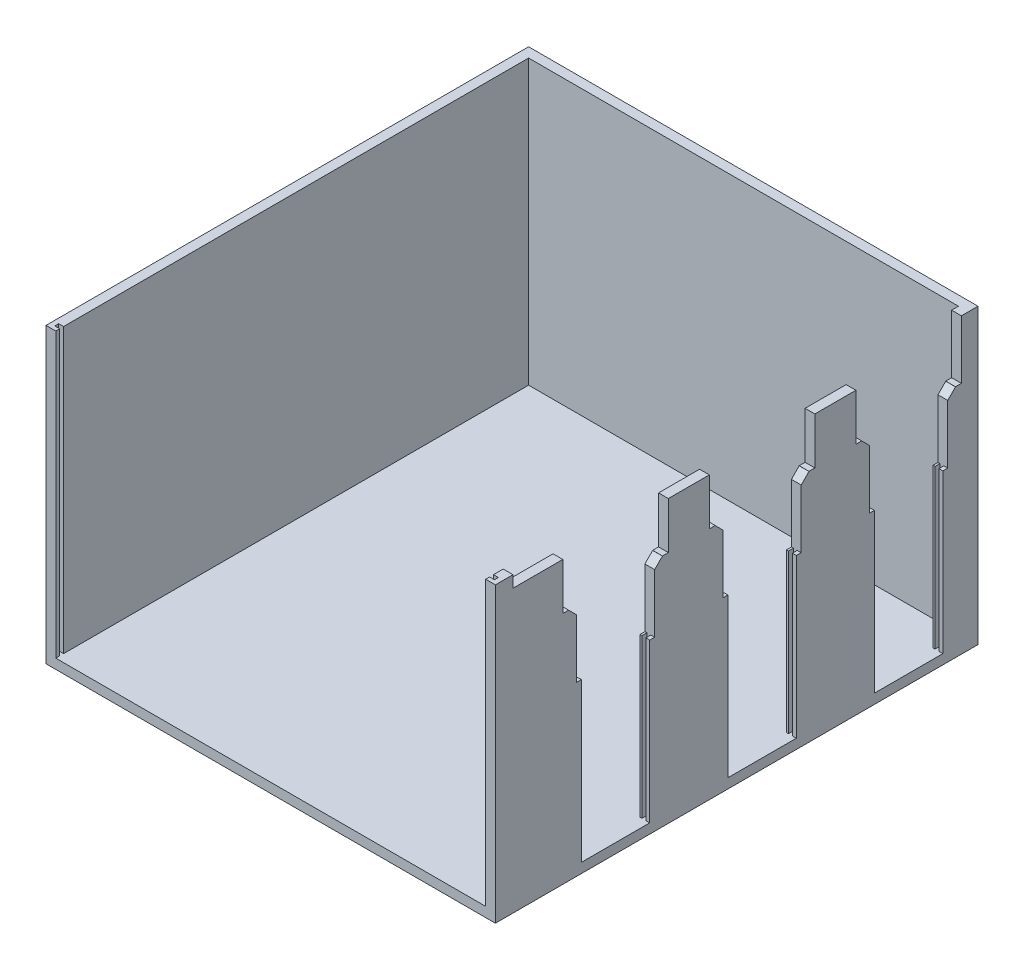
from build123d import *

# Parameters (mm, degrees)
SZKIC1_W                    = 230
SZKIC1_H                    = 150
DODANIE_WYCI_GNI_CIE1_DEPTH = 5
DODANIE_WYCI_GNI_CIE2_DEPTH = 242
WYTNIJ_WYCI_GNI_CIE1_REACH  = 347.737
SZKIC4_W                    = 30
SZKIC4_H                    = 6
WYTNIJ_WYCI_GNI_CIE2_DEPTH  = 5
SZKIC7_W                    = 2.5
SZKIC7_H                    = 2
WYTNIJ_WYCI_GNI_CIE3_DEPTH  = 145


with BuildPart() as part:
    # Szkic1 → Dodanie-wyciągnięcie1 (new body)
    with BuildSketch(Plane.XY):
        Rectangle(SZKIC1_W, SZKIC1_H)
    extrude(amount=DODANIE_WYCI_GNI_CIE1_DEPTH)

    # Szkic3 → Dodanie-wyciągnięcie2 (add)
    with BuildSketch(Plane.XY.offset(5)):
        Polygon((115, -75), (115, 75), (110, 75), (110, 70), (110, -70), (-110, -70), (-110, 70), (-110, 75), (-115, 75), (-115, -75), align=None)
    extrude(amount=DODANIE_WYCI_GNI_CIE2_DEPTH)

    # Szkic4 → Wytnij-wyciągnięcie1 (cut, up to next)
    with BuildSketch(Plane(origin=(115, 0, 0), x_dir=(0, 0, -1), z_dir=(1, 0, 0)), mode=Mode.PRIVATE) as wytnij_wyci_gni_cie1_sk1:
        with Locations((-223, 72)):
            Rectangle(SZKIC4_W, SZKIC4_H)
    wytnij_wyci_gni_cie1_tool1 = extrude(wytnij_wyci_gni_cie1_sk1.sketch, amount=-WYTNIJ_WYCI_GNI_CIE1_REACH, mode=Mode.PRIVATE) & part.part
    # Szkic4 → Wytnij-wyciągnięcie1 (cut, up to next)
    with BuildSketch(Plane(origin=(115, 0, 0), x_dir=(0, 0, -1), z_dir=(1, 0, 0)), mode=Mode.PRIVATE) as wytnij_wyci_gni_cie1_sk2:
        with Locations((-148, 72)):
            Rectangle(SZKIC4_W, SZKIC4_H)
    wytnij_wyci_gni_cie1_tool2 = extrude(wytnij_wyci_gni_cie1_sk2.sketch, amount=-WYTNIJ_WYCI_GNI_CIE1_REACH, mode=Mode.PRIVATE) & part.part
    # Szkic4 → Wytnij-wyciągnięcie1 (cut, up to next)
    with BuildSketch(Plane(origin=(115, 0, 0), x_dir=(0, 0, -1), z_dir=(1, 0, 0)), mode=Mode.PRIVATE) as wytnij_wyci_gni_cie1_sk3:
        with Locations((-73, 72)):
            Rectangle(SZKIC4_W, SZKIC4_H)
    wytnij_wyci_gni_cie1_tool3 = extrude(wytnij_wyci_gni_cie1_sk3.sketch, amount=-WYTNIJ_WYCI_GNI_CIE1_REACH, mode=Mode.PRIVATE) & part.part
    add(wytnij_wyci_gni_cie1_tool1.solids().sort_by_distance((115, 72, 223))[0], mode=Mode.SUBTRACT)
    add(wytnij_wyci_gni_cie1_tool2.solids().sort_by_distance((115, 72, 148))[0], mode=Mode.SUBTRACT)
    add(wytnij_wyci_gni_cie1_tool3.solids().sort_by_distance((115, 72, 73))[0], mode=Mode.SUBTRACT)

    # Szkic6 → Wytnij-wyciągnięcie2 (cut)
    with BuildSketch(Plane(origin=(115, 0, 0), x_dir=(0, 0, -1), z_dir=(1, 0, 0))):
        Polygon((-11.5, 45), (-11.5, 45.054636006), (-8.5, 45.054636006), (-8.5, 75), (-58, 75), (-58, 69), (-62.5, 69), (-62.5, 45.054636006), (-59.5, 45.054636006), (-59.5, 45), (-55.5, 41), (-55.5, 11), (-15.5, 11), (-15.5, 41), align=None)
        Polygon((-83.5, 45.054636006), (-83.5, 69), (-88, 69), (-88, 75), (-133, 75), (-133, 69), (-137.5, 69), (-137.5, 45.054636006), (-134.5, 45.054636006), (-134.5, 45), (-130.5, 41), (-130.5, 11), (-90.5, 11), (-90.5, 41), (-86.5, 45), (-86.5, 45.054636006), align=None)
        Polygon((-158.5, 45.054636006), (-158.5, 69), (-163, 69), (-163, 75), (-208, 75), (-208, 69), (-212.5, 69), (-212.5, 45.054636006), (-209.5, 45.054636006), (-209.5, 45), (-205.5, 41), (-205.5, 11), (-165.5, 11), (-165.5, 41), (-161.5, 45), (-161.5, 45.054636006), align=None)
    extrude(amount=-WYTNIJ_WYCI_GNI_CIE2_DEPTH, mode=Mode.SUBTRACT)

    # Szkic7 → Wytnij-wyciągnięcie3 (cut)
    with BuildSketch(Plane(origin=(0, 75, 0), x_dir=(1, 0, 0), z_dir=(0, 1, 0))):
        with Locations((-111.25, -244)):
            Rectangle(SZKIC7_W, SZKIC7_H)
        with Locations((111.25, -244)):
            Rectangle(SZKIC7_W, SZKIC7_H)
        Polygon((111, -203), (111, -205.5), (113, -205.5), (113, -203), (115, -203), (115, -168), (113, -168), (113, -165.5), (111, -165.5), (111, -168), (110, -168), (110, -203), align=None)
        Polygon((111, -128), (111, -130.5), (113, -130.5), (113, -128), (115, -128), (115, -93), (113, -93), (113, -90.5), (111, -90.5), (111, -93), (110, -93), (110, -128), align=None)
        Polygon((111, -53), (111, -55.5), (113, -55.5), (113, -53), (115, -53), (115, -18), (113, -18), (113, -15.5), (111, -15.5), (111, -18), (110, -18), (110, -53), align=None)
    extrude(amount=-WYTNIJ_WYCI_GNI_CIE3_DEPTH, mode=Mode.SUBTRACT)


solid = part.part
